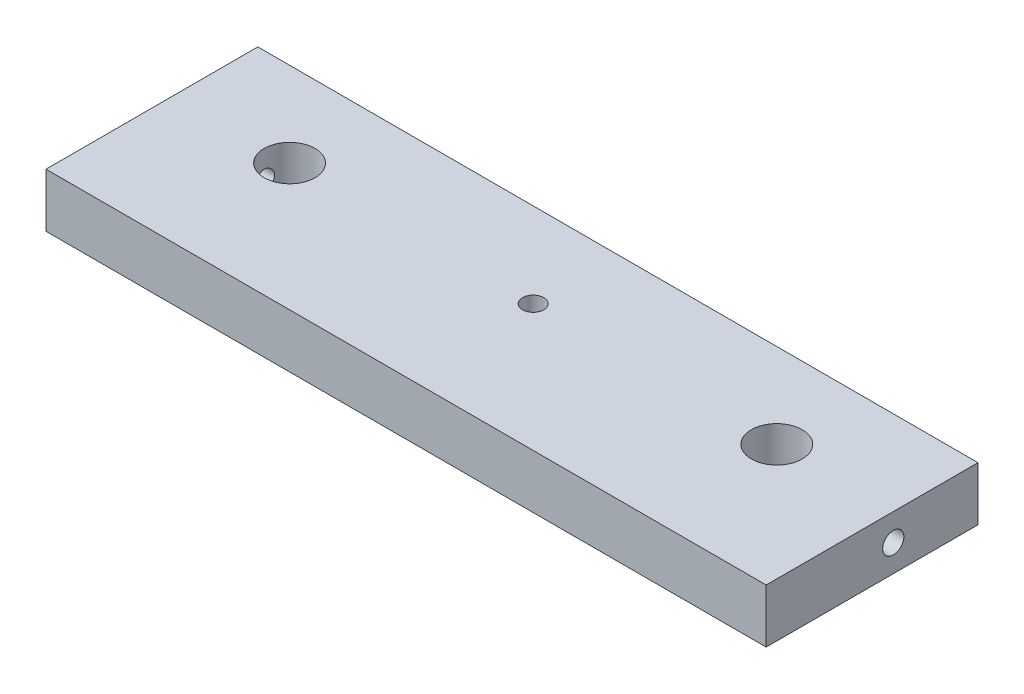
from build123d import *

# Parameters (mm, degrees)
ESBO_O1_W                = 150
ESBO_O1_H                = 40
ESBO_O1_R                = 2.5
ESBO_O1_R_2              = 6
RESSALTO_EXTRUS_O1_DEPTH = 12.7
ESBO_O4_R                = 5.5
CORTE_EXTRUS_O1_DEPTH    = 8
ESBO_O7_W                = 150
ESBO_O7_H                = 10
RESSALTO_EXTRUS_O4_DEPTH = 12.7
ESBO_O8_W                = 10
ESBO_O8_H                = 50
RESSALTO_EXTRUS_O5_DEPTH = 12.7
ESBO_O9_R                = 2
CORTE_EXTRUS_O2_DEPTH    = 10


with BuildPart() as part:
    # Esboço1 → Ressalto-extrusão1 (new body)
    with BuildSketch(Plane(origin=(0, 0, 0), x_dir=(1, 0, 0), z_dir=(0, 1, 0))):
        Rectangle(ESBO_O1_W, ESBO_O1_H)
        with Locations(Location((0, 0, 0), (0, 0, 270))):
            Circle(ESBO_O1_R, mode=Mode.SUBTRACT)
        with Locations(Location((-57.5, 0, 0), (0, 0, 270))):
            Circle(ESBO_O1_R_2, mode=Mode.SUBTRACT)
        with Locations(Location((57.5, 0, 0), (0, 0, 270))):
            Circle(ESBO_O1_R_2, mode=Mode.SUBTRACT)
    extrude(amount=RESSALTO_EXTRUS_O1_DEPTH)

    # Esboço4 → Corte-extrusão1 (cut)
    with BuildSketch(Plane.XZ):
        with Locations(Location((0, 0, 0), (0, 0, 270))):
            Circle(ESBO_O4_R)
    extrude(amount=-CORTE_EXTRUS_O1_DEPTH, mode=Mode.SUBTRACT)

    # Esboço7 → Ressalto-extrusão4 (add)
    with BuildSketch(Plane.XZ):
        with Locations((0, 25)):
            Rectangle(ESBO_O7_W, ESBO_O7_H)
    extrude(amount=-RESSALTO_EXTRUS_O4_DEPTH)

    # Esboço8 → Ressalto-extrusão5 (add)
    with BuildSketch(Plane.XZ):
        with Locations((-80, 5)):
            Rectangle(ESBO_O8_W, ESBO_O8_H)
        with Locations((80, 5)):
            Rectangle(ESBO_O8_W, ESBO_O8_H)
    extrude(amount=-RESSALTO_EXTRUS_O5_DEPTH)

    # Esboço9 → Corte-extrusão2 (cut)
    with BuildSketch(Plane(origin=(85, 0, 0), x_dir=(0, 0, -1), z_dir=(1, 0, 0))):
        with Locations((0, 6.35)):
            Circle(ESBO_O9_R)
    corte_extrus_o2 = extrude(amount=-CORTE_EXTRUS_O2_DEPTH, mode=Mode.SUBTRACT)

    # Esboço13 → Furo roscado de M52 (revolve, cut)
    with BuildSketch(Plane(origin=(85, 6.35, 0), x_dir=(0, 0, -1), z_dir=(0, 1, 0))):
        Polygon((0, 0), (0, 30.2618073), (2.1, 29), (2.1, 5), (2.5, 5), (2.5, 0), align=None)
    furo_roscado_de_m52 = revolve(axis=Axis((91.35, 6.35, 0), (-1, 0, 0)), mode=Mode.SUBTRACT)

    # Espelhar1: Corte-extrusão2, Furo roscado de M52 across plane
    add(corte_extrus_o2.mirror(Plane(origin=(0, 0, 0), x_dir=(0, 0, 1), z_dir=(1, 0, 0))), mode=Mode.SUBTRACT)
    add(furo_roscado_de_m52.mirror(Plane(origin=(0, 0, 0), x_dir=(0, 0, 1), z_dir=(1, 0, 0))), mode=Mode.SUBTRACT)


solid = part.part
